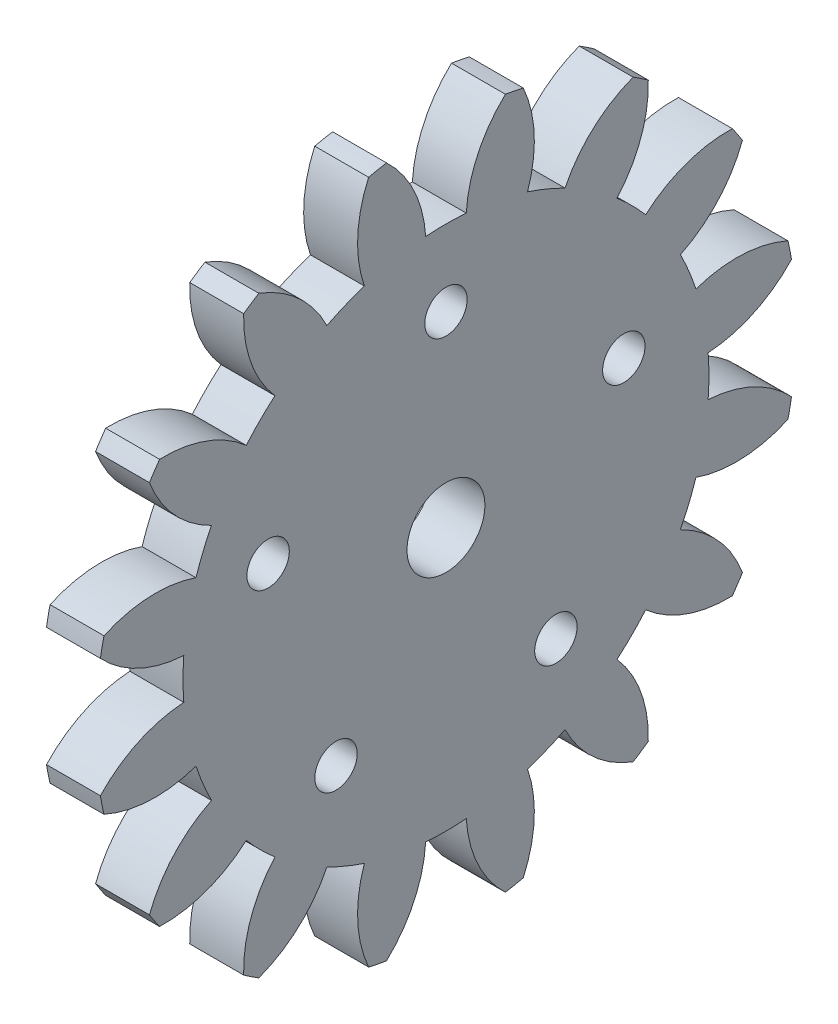
from build123d import *

# Parameters (mm, degrees)
BASPROSKE_W        = 11.811
BASPROSKE_H        = 28.575
TOOTHCUT_DEPTH     = 43.101792967
TEETHCUTS_COUNT    = 16
TEETHCUTS_ANGLE    = 337.5
BORSKE_R           = 0.396875
BORE_DEPTH         = 50.8000508
SKETCH1_R          = 3.175
CUT_EXTRUDE1_DEPTH = 42.540449503
SKETCH2_R          = 1.7272
CUT_EXTRUDE2_DEPTH = 42.540449503
SKETCH3_W          = 84.477604546
SKETCH3_H          = 60.621692784
CUT_EXTRUDE3_DEPTH = 7.4168


with BuildPart() as part:
    # BasProSke → Base-Revolve (revolve)
    with BuildSketch(Plane(origin=(0, 0, 0), x_dir=(1, 0, 0), z_dir=(0, 1, 0)), mode=Mode.PRIVATE) as base_revolve_sk:
        with Locations((5.9055, 14.2875)):
            Rectangle(BASPROSKE_W, BASPROSKE_H)
    revolve(base_revolve_sk.sketch.rotate(Axis((-10, 0, 0), (1, 0, 0)), 180), axis=Axis((-10, 0, 0), (1, 0, 0)))

    # TooCutSke → ToothCut (cut, through all)
    with BuildSketch(Plane(origin=(0, 0, 0), x_dir=(0, 0, -1), z_dir=(1, 0, 0))):
        with BuildLine():
            ThreePointArc((1.653773222, 21.366073035), (0, 21.42998), (-1.653773222, 21.366073035))
            ThreePointArc((-1.653773222, 21.366073035), (-2.605634946, 25.083646688), (-4.868483936, 28.182986789))
            ThreePointArc((-4.868483936, 28.182986789), (0, 28.6004), (4.868483936, 28.182986789))
            ThreePointArc((4.868483936, 28.182986789), (2.605634946, 25.083646688), (1.653773222, 21.366073035))
        make_face()
    toothcut = extrude(amount=TOOTHCUT_DEPTH, mode=Mode.SUBTRACT)

    # TeethCuts: ToothCut ×16 about axis
    teethcuts_axis = Axis((-10, 0, 0), (1, 0, 0))
    for i in range(1, TEETHCUTS_COUNT):
        add(toothcut.rotate(teethcuts_axis, i * TEETHCUTS_ANGLE / (TEETHCUTS_COUNT - 1)), mode=Mode.SUBTRACT)

    # BorSke → Bore (cut, symmetric)
    with BuildSketch(Plane(origin=(0, 0, 0), x_dir=(0, 0, -1), z_dir=(1, 0, 0))):
        with Locations(Location((0, 0, 0), (0, 0, 180))):
            Circle(BORSKE_R)
    extrude(amount=BORE_DEPTH, both=True, mode=Mode.SUBTRACT)

    # Sketch1 → Cut-Extrude1 (cut, through all)
    with BuildSketch(Plane(origin=(11.811, 0, 0), x_dir=(0, 0, -1), z_dir=(1, 0, 0))):
        Circle(SKETCH1_R)
    extrude(amount=-CUT_EXTRUDE1_DEPTH, mode=Mode.SUBTRACT)

    # Sketch2 → Cut-Extrude2 (cut, through all)
    with BuildSketch(Plane(origin=(11.811, 0, 0), x_dir=(0, 0, -1), z_dir=(1, 0, 0))):
        with Locations((0, 15.24)):
            Circle(SKETCH2_R)
        with Locations((14.494101308, 4.709418994)):
            Circle(SKETCH2_R)
        with Locations((8.957847245, -12.329418994)):
            Circle(SKETCH2_R)
        with Locations((-8.957847245, -12.329418994)):
            Circle(SKETCH2_R)
        with Locations((-14.494101308, 4.709418994)):
            Circle(SKETCH2_R)
    extrude(amount=-CUT_EXTRUDE2_DEPTH, mode=Mode.SUBTRACT)

    # Sketch3 → Cut-Extrude3 (cut)
    with BuildSketch(Plane.ZY):
        with Locations((1.281804372, -1.088129041)):
            Rectangle(SKETCH3_W, SKETCH3_H)
    extrude(amount=-CUT_EXTRUDE3_DEPTH, mode=Mode.SUBTRACT)


solid = part.part
